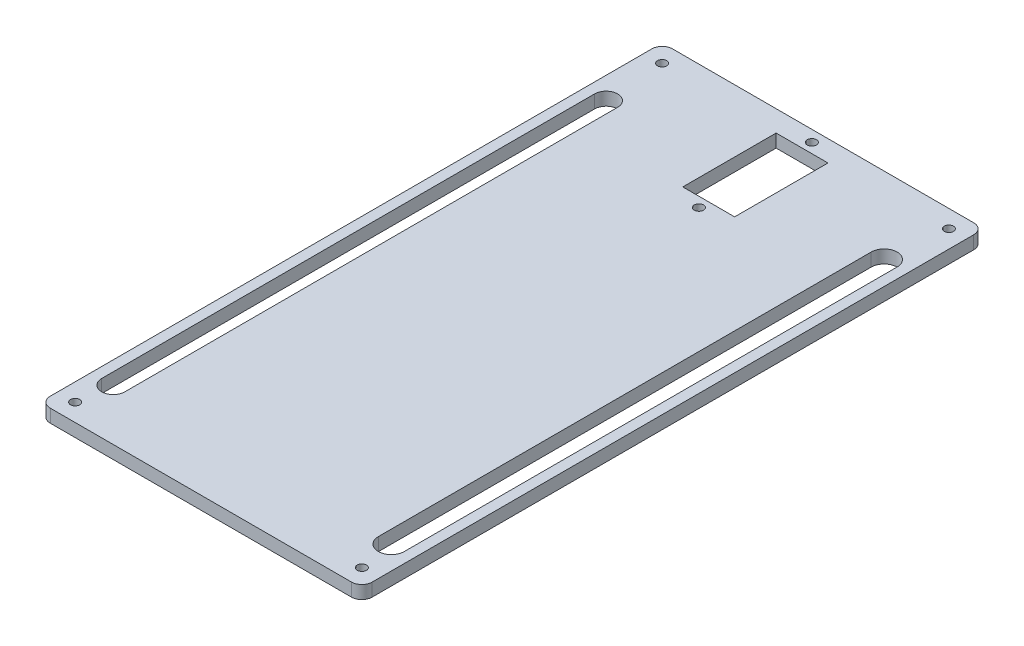
from build123d import *

# Parameters (mm, degrees)
SKETCH2_W           = 78.8444702
SKETCH2_H           = 3.2004
BOSS_EXTRUDE1_DEPTH = 152.4
SKETCH3_R           = 1.1303
SKETCH3_W           = 12.7
SKETCH3_H           = 22.86
CUT_EXTRUDE1_DEPTH  = 159.782256755
FILLET1_R           = 2.54


with BuildPart() as part:
    # Sketch2 → Boss-Extrude1 (new body)
    with BuildSketch(Plane.XY):
        with Locations((-5.0277649, -1.6002)):
            Rectangle(SKETCH2_W, SKETCH2_H)
    extrude(amount=BOSS_EXTRUDE1_DEPTH)

    # Sketch3 → Cut-Extrude1 (cut, through all)
    with BuildSketch(Plane.XZ.offset(3.2004)):
        with Locations(Location((-40.132, 148.082, 0), (0, 0, 270))):
            Circle(SKETCH3_R)
        with Locations(Location((30.0764702, 148.082, 0), (0, 0, 270))):
            Circle(SKETCH3_R)
        with Locations(Location((-40.132, 4.318, 0), (0, 0, 270))):
            Circle(SKETCH3_R)
        with Locations(Location((30.0764702, 4.318, 0), (0, 0, 270))):
            Circle(SKETCH3_R)
        with Locations(Location((-5.0277649, 30.425887591, 0), (0, 0, 270))):
            Circle(SKETCH3_R)
        with Locations(Location((-5.0277649, 2.765287591, 0), (0, 0, 270))):
            Circle(SKETCH3_R)
        with BuildLine():
            Line((-41.91, 19.097412352), (-41.91, 139.804041398))
            ThreePointArc((-41.91, 139.804041398), (-39.076175505, 142.637865893), (-36.24235101, 139.804041398))
            Line((-36.24235101, 139.804041398), (-36.24235101, 19.097412352))
            ThreePointArc((-36.24235101, 19.097412352), (-39.076175505, 16.263587857), (-41.91, 19.097412352))
        make_face()
        with BuildLine():
            Line((25.5044702, 18.756236847), (25.5044702, 139.462865893))
            ThreePointArc((25.5044702, 139.462865893), (28.6794702, 142.637865893), (31.8544702, 139.462865893))
            Line((31.8544702, 139.462865893), (31.8544702, 18.756236847))
            ThreePointArc((31.8544702, 18.756236847), (28.6794702, 15.581236847), (25.5044702, 18.756236847))
        make_face()
        with Locations((-5.0277649, 16.595587591)):
            Rectangle(SKETCH3_W, SKETCH3_H)
    extrude(amount=-CUT_EXTRUDE1_DEPTH, mode=Mode.SUBTRACT)

    # Fillet1
    fillet1_edges = [part.edges().sort_by_distance(p)[0] for p in [
        (34.3944702, -1.6002, 152.4),
        (-44.45, -1.6002, 152.4),
        (34.3944702, -1.6002, 0),
        (-44.45, -1.6002, 0),
    ]]
    fillet(fillet1_edges, radius=FILLET1_R)


solid = part.part
